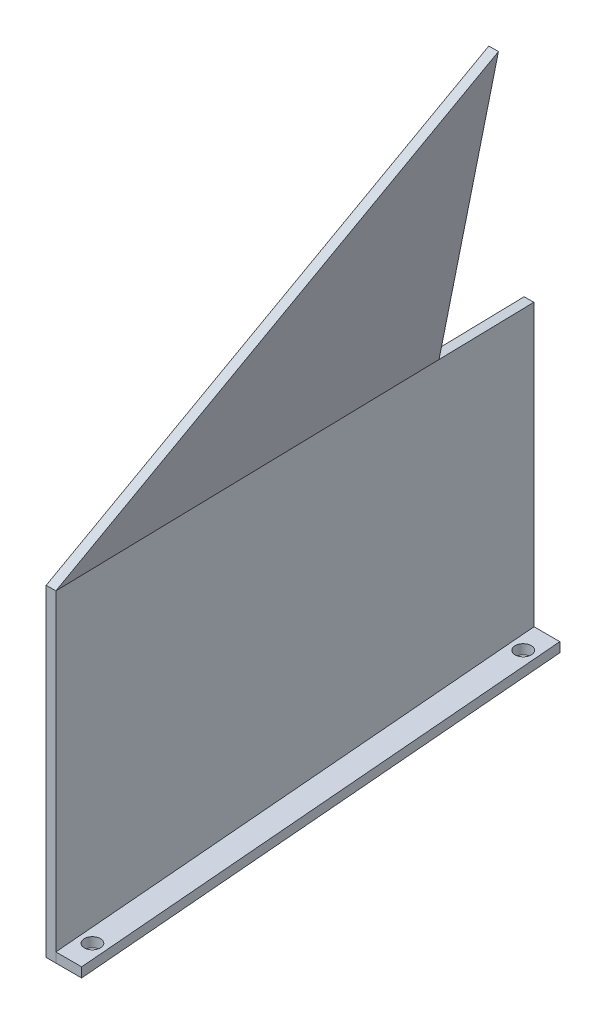
from build123d import *

# Parameters (mm, degrees)
BOSS_EXTRUDE1_DEPTH = 3
SKETCH1_R           = 2.5
BOSS_EXTRUDE2_DEPTH = 3
BOSS_EXTRUDE5_DEPTH = 3


with BuildPart() as part:
    # 3DSketch1 → Boss-Extrude1 (new, along a direction that is not the sketch's normal)
    with BuildSketch(Plane(origin=(-191.853103939, 23, 196.386082525), x_dir=(0.06876662353575062, 0.5251074950069344, 0.8482530696525858), z_dir=(0.9967300562972695, 0, -0.08080343355106794))):
        Polygon((0, 0), (137.697420516, 85.103590916), (190.208170017, 0), (47.360694134, -76.756953147), align=None)
    extrude(amount=BOSS_EXTRUDE1_DEPTH, dir=(1, 0, 0))

    # Sketch1 → Boss-Extrude2 (add)
    with BuildSketch(Plane(origin=(0, 23.146370891, 0.017253018), x_dir=(1, 0, 0), z_dir=(0, -0.9999997221987764, -0.000745387395963266))):
        Polygon((-175.773130318, 357.71359297), (-167.773130318, 357.71359297), (-180.853103939, 196.301655796), (-188.853103939, 196.301655796), align=None)
        with Locations(Location((-172.434519968, 349.71359297, 0), (0, 0, 270))):
            Circle(SKETCH1_R, mode=Mode.SUBTRACT)
        with Locations(Location((-184.217937823, 204.301655796, 0), (0, 0, 270))):
            Circle(SKETCH1_R, mode=Mode.SUBTRACT)
    extrude(amount=-BOSS_EXTRUDE2_DEPTH)

    # 3DSketch2 → Boss-Extrude5 (add, along a direction that is not the sketch's normal)
    with BuildSketch(Plane(origin=(-189.258816585, 115.113773206, 228.387249638), x_dir=(0.08065912513094323, 0.05973817293580263, 0.99494997674627), z_dir=(-0.9586958466573331, 0.27780635378188856, 0.06104017857437458))):
        Polygon((0, 0), (21.385713883, 107.795899991), (130, 0), align=None)
    extrude(amount=-BOSS_EXTRUDE5_DEPTH, dir=(-1, 0, 0))


solid = part.part
